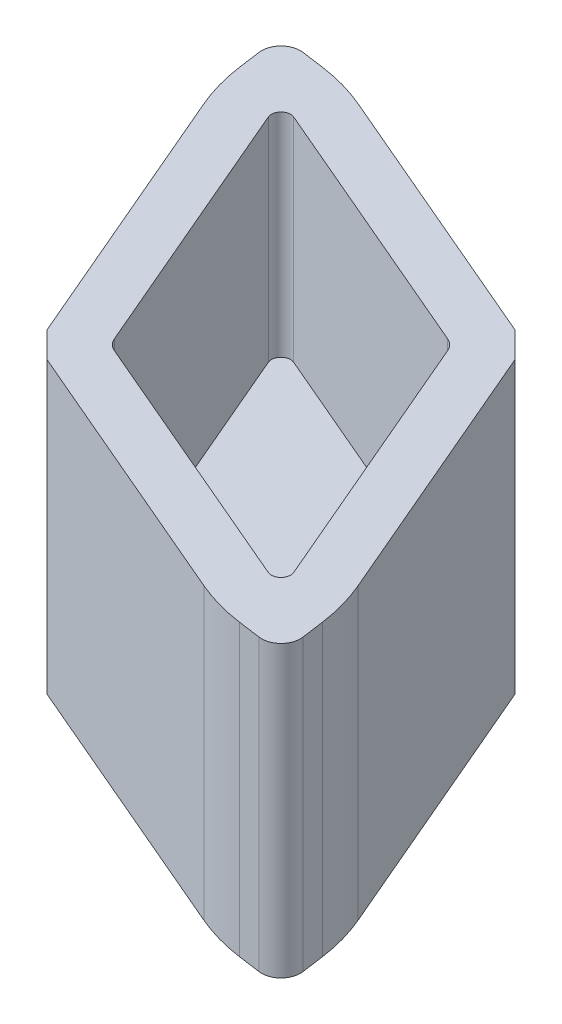
from build123d import *

# Parameters (mm, degrees)
BOSS_EXTRUDE1_DEPTH = 15
BOSS_EXTRUDE2_START = -4
BOSS_EXTRUDE2_DEPTH = 4.000012


with BuildPart() as part:
    # Sketch1 → Boss-Extrude1 (new body)
    with BuildSketch(Plane(origin=(0, 0, 0), x_dir=(1, 0, 0), z_dir=(0, 1, 0))):
        with BuildLine():
            Line((-33.248720492, 21.52614432), (-19.029308571, 15.44140741))
            Line((-19.029308571, 15.44140741), (-17.714430818, 14.126529658))
            Line((-17.714430818, 14.126529658), (-11.629693909, -0.092882264))
            ThreePointArc((-11.629693909, -0.092882264), (-11.188945491, -1.347659996), (-10.918602777, -2.649827859))
            Line((-10.918602777, -2.649827859), (-10.755160033, -3.825322261))
            ThreePointArc((-10.755160033, -3.825322261), (-11.038524889, -4.670145906), (-11.883348535, -4.953510763))
            Line((-11.883348535, -4.953510763), (-13.058842937, -4.790068018))
            ThreePointArc((-13.058842937, -4.790068018), (-14.361010799, -4.519725304), (-15.615788532, -4.078976887))
            Line((-15.615788532, -4.078976887), (-29.835200454, 2.005760022))
            Line((-29.835200454, 2.005760022), (-31.150078206, 3.320637775))
            Line((-31.150078206, 3.320637775), (-37.234815116, 17.540049697))
            ThreePointArc((-37.234815116, 17.540049697), (-37.675563533, 18.794827429), (-37.945906247, 20.096995292))
            Line((-37.945906247, 20.096995292), (-38.109348992, 21.272489694))
            ThreePointArc((-38.109348992, 21.272489694), (-37.825984135, 22.117313339), (-36.98116049, 22.400678196))
            Line((-36.98116049, 22.400678196), (-35.805666088, 22.237235451))
            ThreePointArc((-35.805666088, 22.237235451), (-34.503498225, 21.966892737), (-33.248720492, 21.52614432))
        make_face()
        with BuildLine():
            Line((-34.972142842, 18.607085072), (-29.009288651, 4.672500679))
            ThreePointArc((-29.009288651, 4.672500679), (-28.797032907, 4.358805321), (-28.48333755, 4.146549578))
            Line((-28.48333755, 4.146549578), (-14.548753156, -1.816304613))
            ThreePointArc((-14.548753156, -1.816304613), (-13.998494054, -1.710176742), (-13.892366182, -1.159917639))
            Line((-13.892366182, -1.159917639), (-19.855220374, 12.774666754))
            ThreePointArc((-19.855220374, 12.774666754), (-20.067476117, 13.088362112), (-20.381171475, 13.300617855))
            Line((-20.381171475, 13.300617855), (-34.315755868, 19.263472046))
            ThreePointArc((-34.315755868, 19.263472046), (-34.86601497, 19.157344174), (-34.972142842, 18.607085072))
        make_face(mode=Mode.SUBTRACT)
    extrude(amount=BOSS_EXTRUDE1_DEPTH)

    # Sketch2 → Boss-Extrude2 (add)
    with BuildSketch(Plane.XZ.offset(BOSS_EXTRUDE2_START)):
        Polygon((-12.865216707, 3.215805982), (-29.492692689, -2.90528144), (-36.484014197, -19.947497419), (-32.173846311, -19.947497419), (-18.909952053, -13.83296991), align=None)
    extrude(amount=BOSS_EXTRUDE2_DEPTH)


solid = part.part
